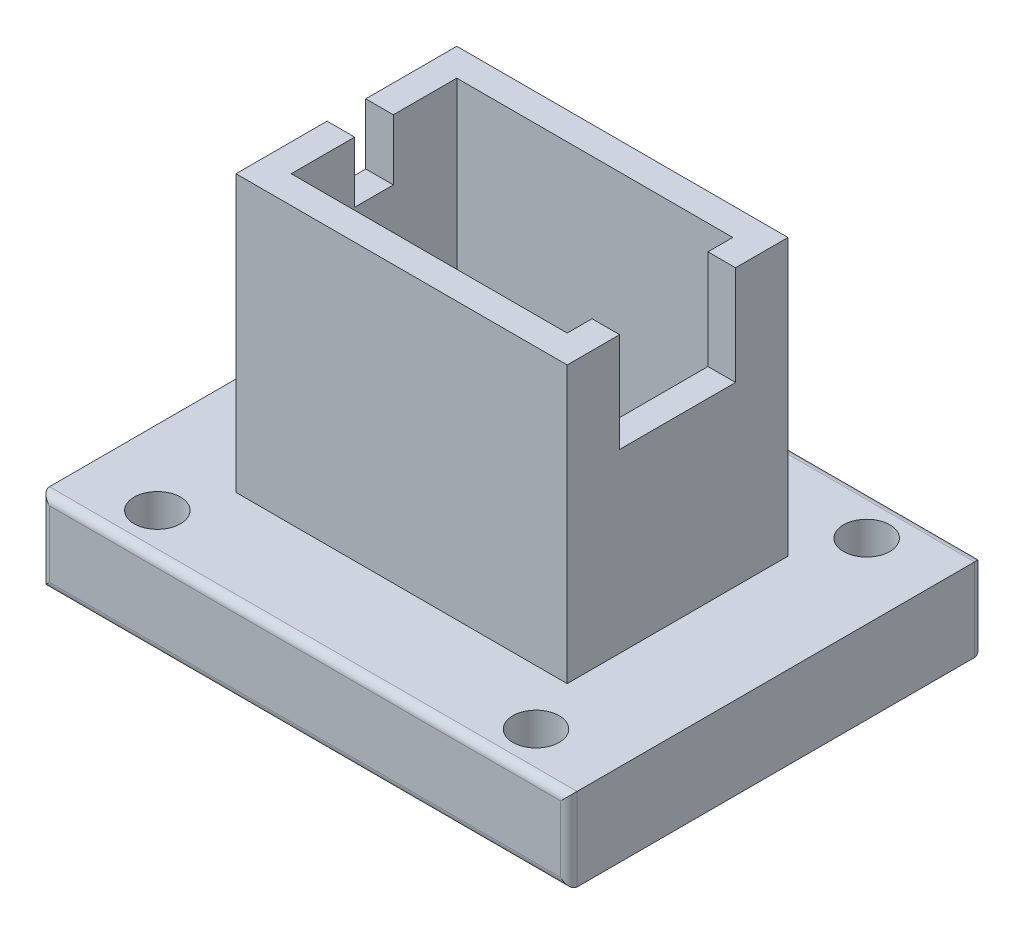
from build123d import *

# Parameters (mm, degrees)
SKETCH_1_W          = 95.6
SKETCH_1_H          = 75
SKETCH_1_R          = 2.415
EXTRUDE_1_DEPTH     = 15
FILLET_1_R          = 1.5
SKETCH_2_W          = 60
SKETCH_2_H          = 40
SKETCH_2_W_2        = 50
SKETCH_2_H_2        = 30
EXTRUDE_2_DEPTH     = 50
SKETCH_3_R          = 4.2
CUT_EXTRUDE_1_DEPTH = 10.5
SKETCH_5_W          = 21
SKETCH_5_H          = 18
CUT_EXTRUDE_2_DEPTH = 5
SKETCH_6_W          = 7
SKETCH_6_H          = 11
CUT_EXTRUDE_3_DEPTH = 5


with BuildPart() as part:
    # 草圖1 → 填料-伸長1 (new body)
    with BuildSketch(Plane(origin=(0, 0, 0), x_dir=(1, 0, 0), z_dir=(0, 1, 0))):
        with Locations((5.640991766, -24.322966942)):
            Rectangle(SKETCH_1_W, SKETCH_1_H)
        with Locations(Location((-28.659008234, -54.272966942, 0), (0, 0, 270))):
            Circle(SKETCH_1_R, mode=Mode.SUBTRACT)
        with Locations(Location((-28.659008234, 5.627033058, 0), (0, 0, 270))):
            Circle(SKETCH_1_R, mode=Mode.SUBTRACT)
        with Locations(Location((39.940991766, 5.627033058, 0), (0, 0, 270))):
            Circle(SKETCH_1_R, mode=Mode.SUBTRACT)
        with Locations(Location((39.940991766, -54.272966942, 0), (0, 0, 270))):
            Circle(SKETCH_1_R, mode=Mode.SUBTRACT)
    extrude(amount=EXTRUDE_1_DEPTH)

    # 圓角1
    fillet_1_edges = [part.edges().sort_by_distance(p)[0] for p in [
        (5.640991766, 15, -13.177033058),
        (5.640991766, 0, -13.177033058),
        (5.640991766, 0, 61.822966942),
        (-42.159008234, 7.5, -13.177033058),
        (53.440991766, 7.5, -13.177033058),
        (53.440991766, 7.5, 61.822966942),
        (-42.159008234, 7.5, 61.822966942),
        (5.640991766, 15, 61.822966942),
    ]]
    fillet(fillet_1_edges, radius=FILLET_1_R)

    # 草圖2 → 填料-伸長2 (add)
    with BuildSketch(Plane(origin=(0, 15, 0), x_dir=(1, 0, 0), z_dir=(0, 1, 0))):
        with Locations((5.640991766, -24.322966942)):
            Rectangle(SKETCH_2_W, SKETCH_2_H)
        with Locations((5.640991766, -24.322966942)):
            Rectangle(SKETCH_2_W_2, SKETCH_2_H_2, mode=Mode.SUBTRACT)
    extrude(amount=EXTRUDE_2_DEPTH)

    # 草圖3 → 除料-伸長1 (cut)
    with BuildSketch(Plane(origin=(0, 15, 0), x_dir=(1, 0, 0), z_dir=(0, 1, 0))):
        with Locations(Location((-28.659008234, 5.627033058, 0), (0, 0, 270))):
            Circle(SKETCH_3_R)
        with Locations(Location((39.940991766, 5.627033058, 0), (0, 0, 270))):
            Circle(SKETCH_3_R)
        with Locations(Location((39.940991766, -54.272966942, 0), (0, 0, 270))):
            Circle(SKETCH_3_R)
        with Locations(Location((-28.659008234, -54.272966942, 0), (0, 0, 270))):
            Circle(SKETCH_3_R)
    extrude(amount=-CUT_EXTRUDE_1_DEPTH, mode=Mode.SUBTRACT)

    # 草圖5 → 除料-伸長2 (cut)
    with BuildSketch(Plane(origin=(35.640991766, 0, 0), x_dir=(0, 0, -1), z_dir=(1, 0, 0))):
        with Locations((-24.322966942, 56)):
            Rectangle(SKETCH_5_W, SKETCH_5_H)
    extrude(amount=-CUT_EXTRUDE_2_DEPTH, mode=Mode.SUBTRACT)

    # 草圖6 → 除料-伸長3 (cut)
    with BuildSketch(Plane.ZY.offset(24.359008234)):
        with Locations((24.322966942, 59.5)):
            Rectangle(SKETCH_6_W, SKETCH_6_H)
    extrude(amount=-CUT_EXTRUDE_3_DEPTH, mode=Mode.SUBTRACT)


solid = part.part
